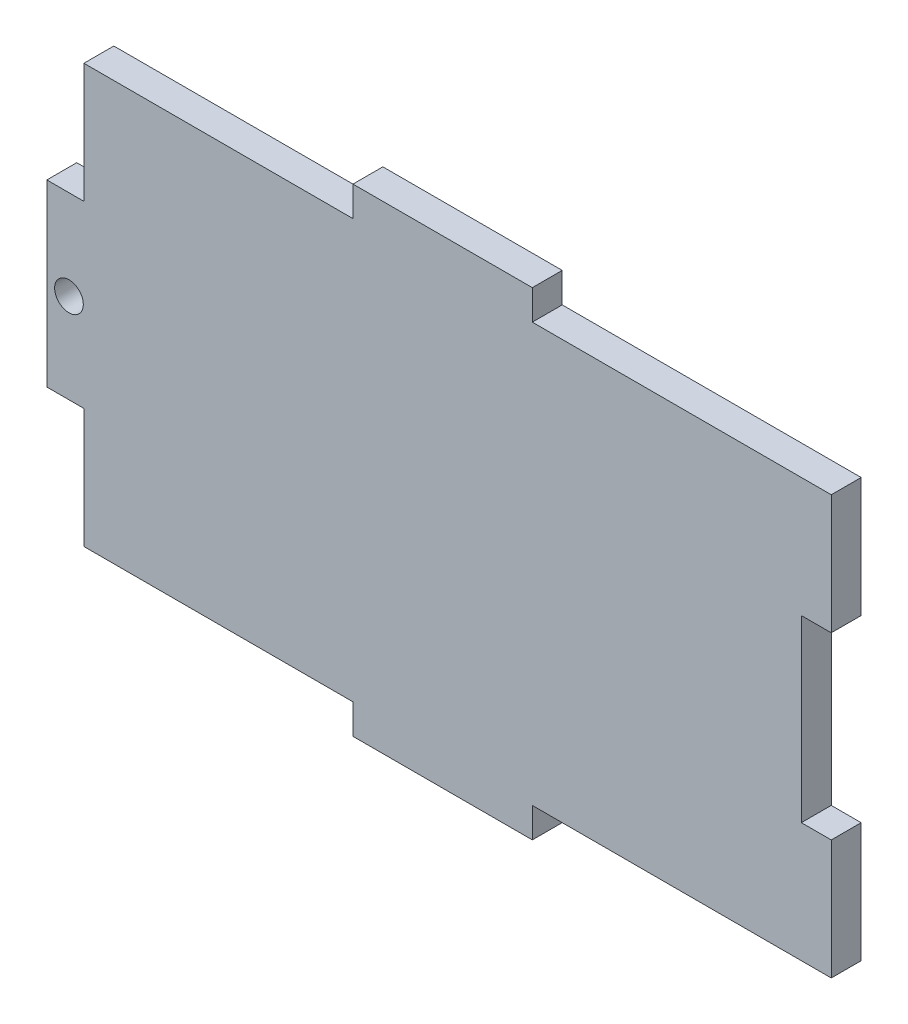
from build123d import *

# Parameters (mm, degrees)
SKETCH1_W           = 79.375
SKETCH1_H           = 44.45
BOSS_EXTRUDE1_DEPTH = 3.175
SKETCH2_W           = 3.175
SKETCH2_H           = 19.05
BOSS_EXTRUDE2_DEPTH = 3.175
SKETCH5_W           = 19.05
SKETCH5_H           = 3.175
BOSS_EXTRUDE3_DEPTH = 3.175
SKETCH3_W           = 3.175
SKETCH3_H           = 19.05
CUT_EXTRUDE1_DEPTH  = 3.175
SKETCH6_W           = 0.762
SKETCH6_H           = 19.05
BOSS_EXTRUDE4_DEPTH = 3.175
SKETCH7_R           = 1.524
CUT_EXTRUDE2_DEPTH  = 93.620796126


with BuildPart() as part:
    # Sketch1 → Boss-Extrude1 (new body)
    with BuildSketch(Plane.XY):
        with Locations((39.6875, 22.225)):
            Rectangle(SKETCH1_W, SKETCH1_H)
    extrude(amount=BOSS_EXTRUDE1_DEPTH)

    # Sketch2 → Boss-Extrude2 (add)
    with BuildSketch(Plane.XY.offset(3.175)):
        with Locations((-1.5875, 22.225)):
            Rectangle(SKETCH2_W, SKETCH2_H)
    extrude(amount=-BOSS_EXTRUDE2_DEPTH)

    # Sketch5 → Boss-Extrude3 (add)
    with BuildSketch(Plane.XY.offset(3.175)):
        with Locations((38.1, 46.0375)):
            Rectangle(SKETCH5_W, SKETCH5_H)
        with Locations((38.1, -1.5875)):
            Rectangle(SKETCH5_W, SKETCH5_H)
    extrude(amount=-BOSS_EXTRUDE3_DEPTH)

    # Sketch3 → Cut-Extrude1 (cut)
    with BuildSketch(Plane.XY.offset(3.175)):
        with Locations((77.7875, 22.225)):
            Rectangle(SKETCH3_W, SKETCH3_H)
    extrude(amount=-CUT_EXTRUDE1_DEPTH, mode=Mode.SUBTRACT)

    # Sketch6 → Boss-Extrude4 (add)
    with BuildSketch(Plane.XY.offset(3.175)):
        with Locations((-3.556, 22.225)):
            Rectangle(SKETCH6_W, SKETCH6_H)
    extrude(amount=-BOSS_EXTRUDE4_DEPTH)

    # Sketch7 → Cut-Extrude2 (cut, through all)
    with BuildSketch(Plane.XY.offset(3.175)):
        with Locations((-1.5875, 22.225)):
            Circle(SKETCH7_R)
    extrude(amount=-CUT_EXTRUDE2_DEPTH, mode=Mode.SUBTRACT)


solid = part.part
